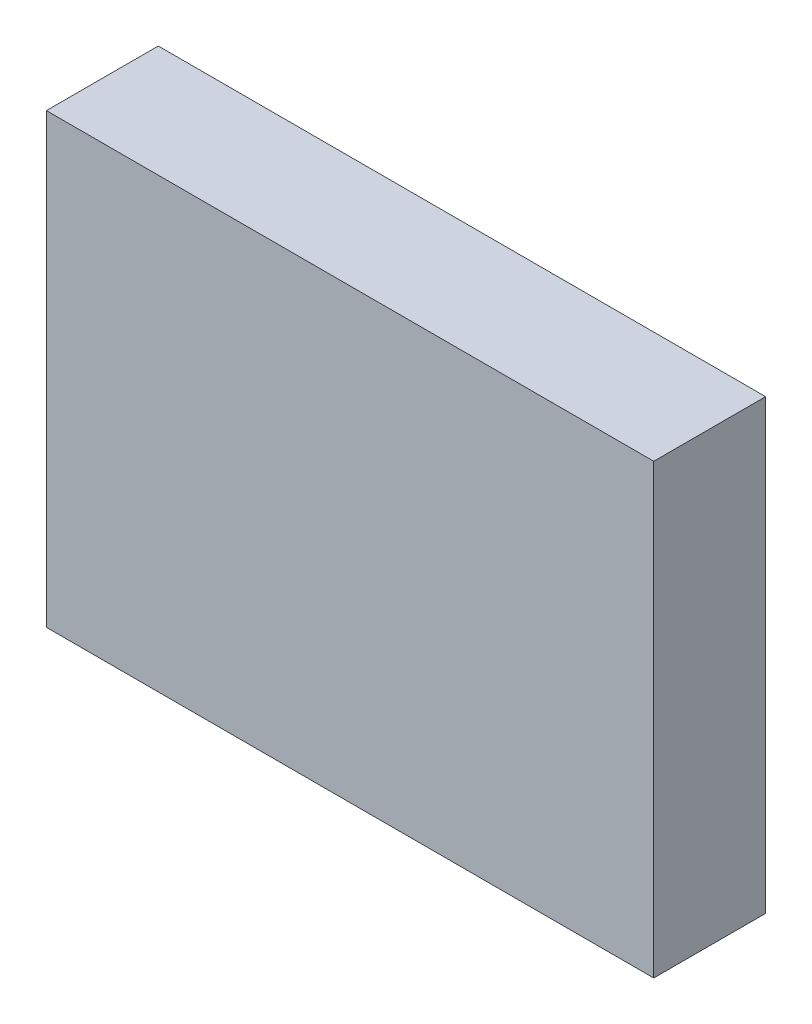
from build123d import *

# Parameters (mm, degrees)
SKETCH_1_W              = 3.8
SKETCH_1_H              = 2.8
COMPONENT_OUTLINE_DEPTH = 0.7


with BuildPart() as part:
    # 草图1 → Component_Outline (new body)
    with BuildSketch(Plane.XY):
        Rectangle(SKETCH_1_W, SKETCH_1_H)
    extrude(amount=COMPONENT_OUTLINE_DEPTH)


solid = part.part
